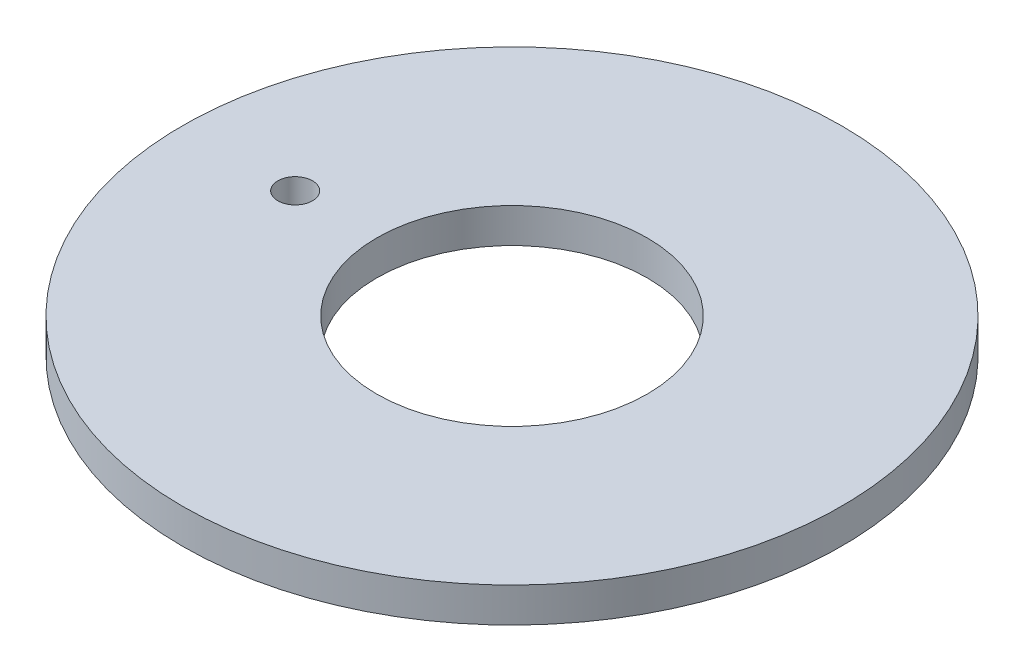
from build123d import *

# Parameters (mm, degrees)
SKETCH1_R           = 38
SKETCH1_R_2         = 15.6
BOSS_EXTRUDE1_DEPTH = 4
SKETCH2_R           = 2
CUT_EXTRUDE1_DEPTH  = 54.888774341


with BuildPart() as part:
    # Sketch1 → Boss-Extrude1 (new body)
    with BuildSketch(Plane(origin=(0, 0, 0), x_dir=(1, 0, 0), z_dir=(0, 1, 0))):
        with Locations(Location((0, 0, 0), (0, 0, 270))):
            Circle(SKETCH1_R)
        with Locations(Location((0, 0, 0), (0, 0, 270))):
            Circle(SKETCH1_R_2, mode=Mode.SUBTRACT)
    extrude(amount=BOSS_EXTRUDE1_DEPTH)

    # Sketch2 → Cut-Extrude1 (cut, through all)
    with BuildSketch(Plane(origin=(0, 4, 0), x_dir=(1, 0, 0), z_dir=(0, 1, 0))):
        with Locations(Location((-25, 0, 0), (0, 0, 270))):
            Circle(SKETCH2_R)
    extrude(amount=-CUT_EXTRUDE1_DEPTH, mode=Mode.SUBTRACT)


solid = part.part
